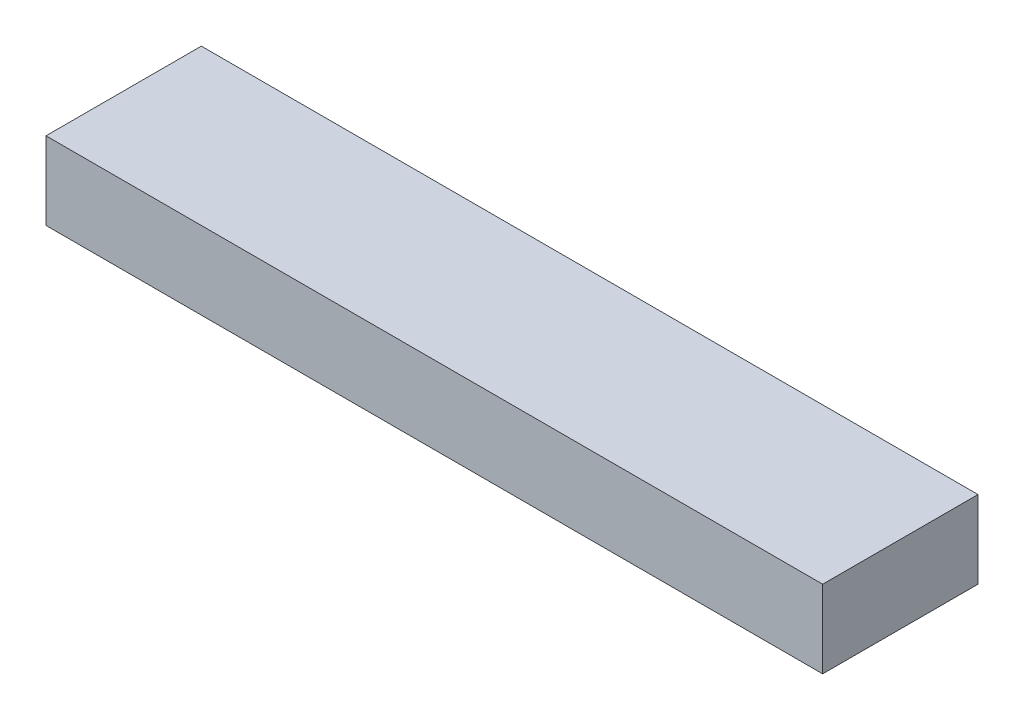
from build123d import *

# Parameters (mm, degrees)
SKETCH1_W           = 100
SKETCH1_H           = 10
BOSS_EXTRUDE1_DEPTH = 20


with BuildPart() as part:
    # Sketch1 → Boss-Extrude1 (new body)
    with BuildSketch(Plane.XY):
        with Locations((50, 5)):
            Rectangle(SKETCH1_W, SKETCH1_H)
    extrude(amount=BOSS_EXTRUDE1_DEPTH)


solid = part.part
